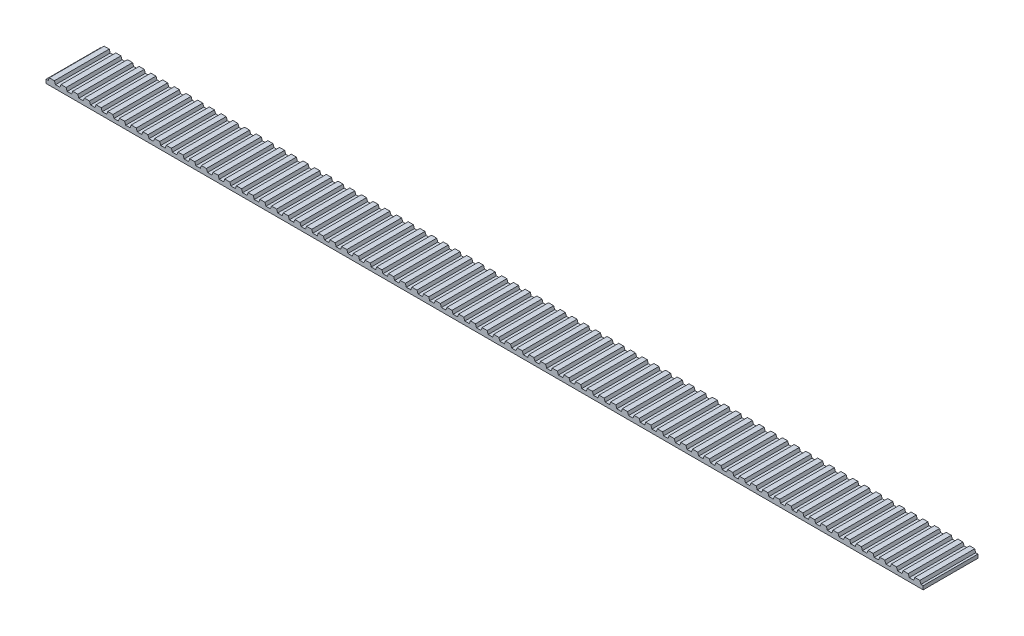
from build123d import *

# Parameters (mm, degrees)
SKETCH1_W           = 152.4
SKETCH1_H           = 1.143
BOSS_EXTRUDE1_DEPTH = 4.7625
CUT_EXTRUDE1_DEPTH  = 153.478680002
LPATTERN1_COUNT     = 76
LPATTERN1_PITCH     = 2.032


with BuildPart() as part:
    # Sketch1 → Boss-Extrude1 (new, symmetric)
    with BuildSketch(Plane.XY):
        with Locations((76.2, 0.5715)):
            Rectangle(SKETCH1_W, SKETCH1_H)
    extrude(amount=BOSS_EXTRUDE1_DEPTH, both=True)

    # Sketch2 → Cut-Extrude1 (cut, symmetric)
    with BuildSketch(Plane.XY):
        Polygon((-0.5715, 1.143), (-0.386603121, 0.635), (0.386603121, 0.635), (0.5715, 1.143), align=None)
    cut_extrude1 = extrude(amount=CUT_EXTRUDE1_DEPTH, both=True, mode=Mode.SUBTRACT)

    # LPattern1: Cut-Extrude1 ×76
    with Locations(*[(i * LPATTERN1_PITCH, 0, 0) for i in range(1, LPATTERN1_COUNT)]):
        add(cut_extrude1, mode=Mode.SUBTRACT)


solid = part.part
